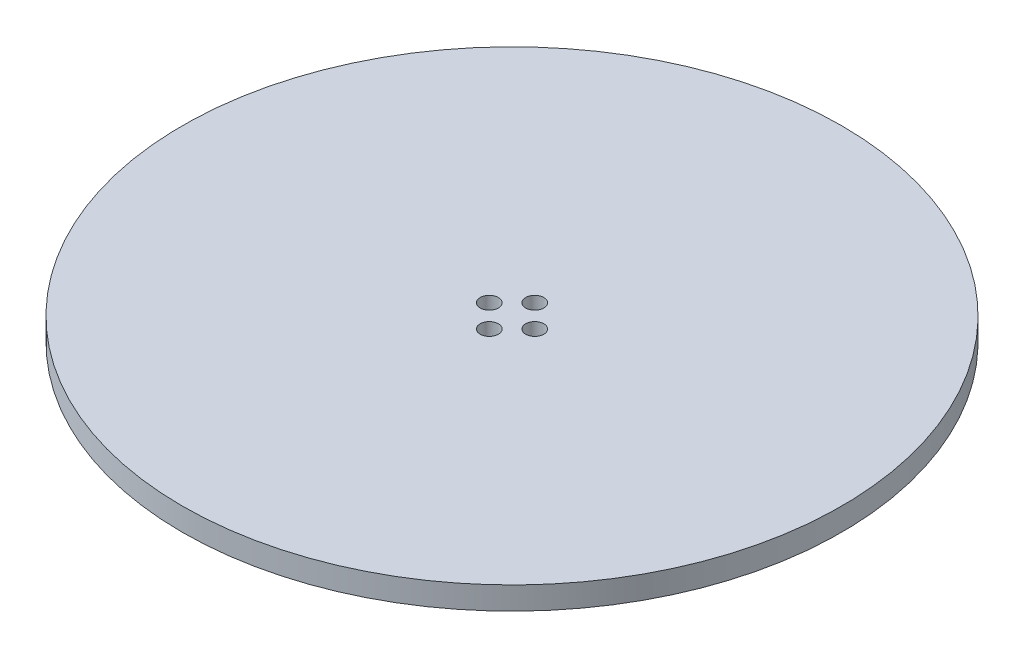
from build123d import *

# Parameters (mm, degrees)
SKETCH_6_R      = 72.5
SKETCH_6_R_2    = 2
EXTRUDE_2_DEPTH = 5


with BuildPart() as part:
    # 草圖6 → 填料-伸長2 (new body)
    with BuildSketch(Plane(origin=(0, 0, 0), x_dir=(1, 0, 0), z_dir=(0, 1, 0))):
        Circle(SKETCH_6_R)
        with Locations((0, -5)):
            Circle(SKETCH_6_R_2, mode=Mode.SUBTRACT)
        with Locations((-5, 0)):
            Circle(SKETCH_6_R_2, mode=Mode.SUBTRACT)
        with Locations((5, 0)):
            Circle(SKETCH_6_R_2, mode=Mode.SUBTRACT)
        with Locations((0, 5)):
            Circle(SKETCH_6_R_2, mode=Mode.SUBTRACT)
    extrude(amount=EXTRUDE_2_DEPTH)


solid = part.part
